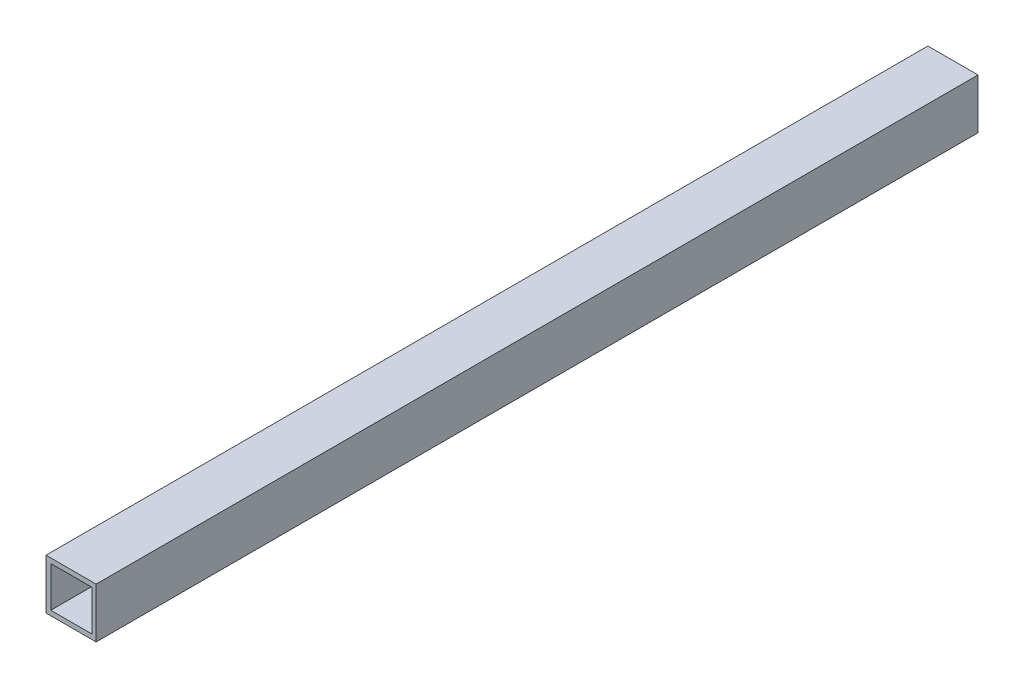
from build123d import *

# Parameters (mm, degrees)
SKETCH1_W           = 15.875
SKETCH1_H           = 15.875
BOSS_EXTRUDE1_DEPTH = 279.4
SKETCH4_W           = 13.0683
SKETCH4_H           = 12.827
CUT_EXTRUDE1_DEPTH  = 281.30053737


with BuildPart() as part:
    # Sketch1 → Boss-Extrude1 (new body)
    with BuildSketch(Plane.XY):
        with Locations((7.9375, 7.9375)):
            Rectangle(SKETCH1_W, SKETCH1_H)
    extrude(amount=BOSS_EXTRUDE1_DEPTH)

    # Sketch4 → Cut-Extrude1 (cut, through all)
    with BuildSketch(Plane.XY.offset(279.4)):
        with Locations((8.05815, 7.9375)):
            Rectangle(SKETCH4_W, SKETCH4_H)
    extrude(amount=-CUT_EXTRUDE1_DEPTH, mode=Mode.SUBTRACT)


solid = part.part
